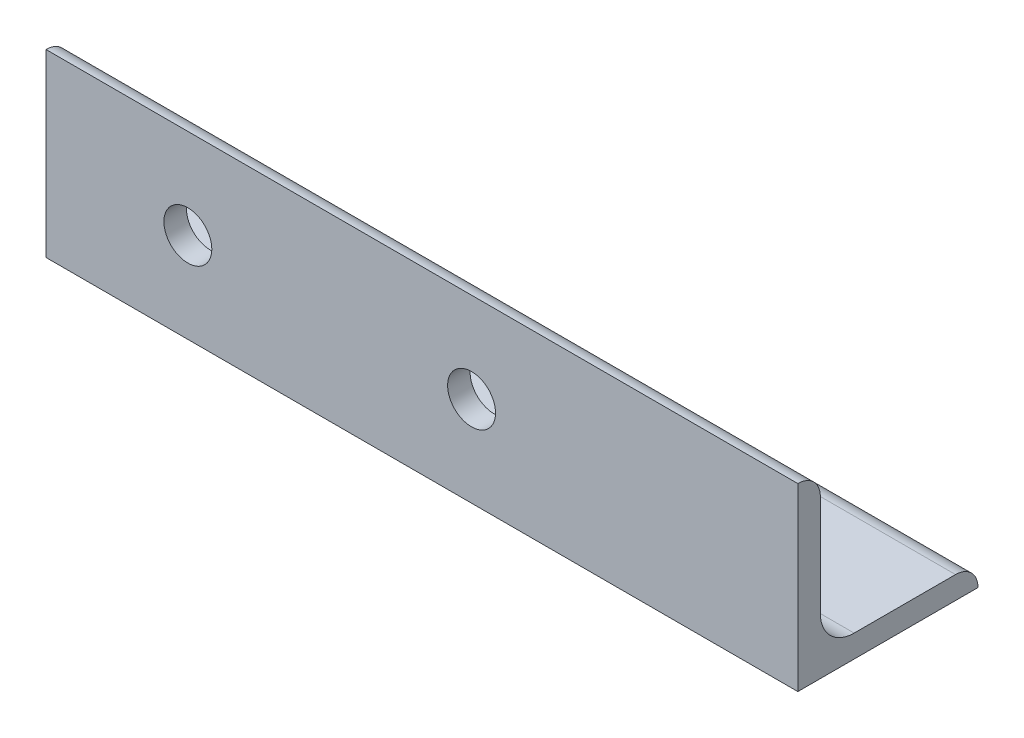
from build123d import *

# Parameters (mm, degrees)
MIEMBRO_ESTRUCTURAL1_DEPTH    = 106
TALADRO_DE_MARGEN_PARA_1_41_D = 6.7564


with BuildPart() as part:
    # Sketch12 → Miembro estructural1 (new body)
    with BuildSketch(Plane(origin=(-95.224809186, 0, 0), x_dir=(0, 0, -1), z_dir=(1, 0, 0))):
        with BuildLine():
            Line((0, 0), (0, 25.4))
            Line((0, 25.4), (0.00508, 25.4))
            ThreePointArc((0.00508, 25.4), (2.246551928, 24.471551928), (3.175, 22.23008))
            Line((3.175, 22.23008), (3.175, 7.9375))
            ThreePointArc((3.175, 7.9375), (4.569903955, 4.569903955), (7.9375, 3.175))
            Line((7.9375, 3.175), (22.23008, 3.175))
            ThreePointArc((22.23008, 3.175), (24.471551928, 2.246551928), (25.4, 0.00508))
            Line((25.4, 0.00508), (25.4, 0))
            Line((25.4, 0), (0, 0))
        make_face()
    extrude(amount=MIEMBRO_ESTRUCTURAL1_DEPTH)

    # Taladro de margen para 1/41 (through all)
    with Locations(Plane.XY):
        with Locations((-35.224809186, 12.7), (-75.224809186, 12.7)):
            Hole(TALADRO_DE_MARGEN_PARA_1_41_D / 2)


solid = part.part
